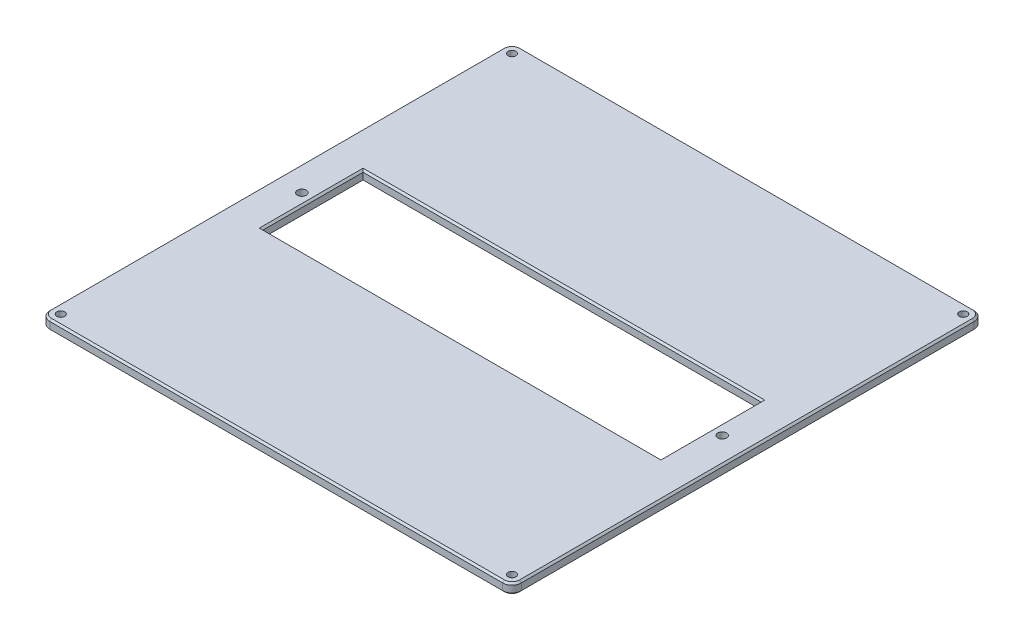
from build123d import *

# Parameters (mm, degrees)
SKETCH1_W           = 266.7
SKETCH1_H           = 266.7
SKETCH1_R           = 2.225
SKETCH1_R_2         = 2.5
SKETCH1_W_2         = 225.2
SKETCH1_H_2         = 56.7
BOSS_EXTRUDE1_DEPTH = 5.8
FILLET1_R           = 5.25
CHAMFER1_SIZE       = 1


with BuildPart() as part:
    # Sketch1 → Boss-Extrude1 (new body)
    with BuildSketch(Plane(origin=(0, 0, 0), x_dir=(1, 0, 0), z_dir=(0, 1, 0))):
        Rectangle(SKETCH1_W, SKETCH1_H)
        with Locations(Location((-127.625, 127.625, 0), (0, 0, 270))):
            Circle(SKETCH1_R, mode=Mode.SUBTRACT)
        with Locations(Location((127.625, 127.625, 0), (0, 0, 270))):
            Circle(SKETCH1_R, mode=Mode.SUBTRACT)
        with Locations(Location((127.625, -127.625, 0), (0, 0, 270))):
            Circle(SKETCH1_R, mode=Mode.SUBTRACT)
        with Locations(Location((-127.625, -127.625, 0), (0, 0, 270))):
            Circle(SKETCH1_R, mode=Mode.SUBTRACT)
        with Locations(Location((118.9, 0, 0), (0, 0, 270))):
            Circle(SKETCH1_R_2, mode=Mode.SUBTRACT)
        with Locations(Location((-118.9, 0, 0), (0, 0, 270))):
            Circle(SKETCH1_R_2, mode=Mode.SUBTRACT)
        Rectangle(SKETCH1_W_2, SKETCH1_H_2, mode=Mode.SUBTRACT)
    extrude(amount=BOSS_EXTRUDE1_DEPTH)

    # Fillet1
    fillet1_edges = [part.edges().sort_by_distance(p)[0] for p in [
        (133.35, 2.9, 133.35),
        (-133.35, 2.9, 133.35),
        (-133.35, 2.9, -133.35),
        (133.35, 2.9, -133.35),
    ]]
    fillet(fillet1_edges, radius=FILLET1_R)

    # Chamfer1
    chamfer1_edges = [part.edges().sort_by_distance(p)[0] for p in [
        (112.6, 0, 0),
        (0, 0, -28.35),
        (-112.6, 0, 0),
        (0, 0, 28.35),
        (112.6, 5.8, 0),
        (0, 5.8, -28.35),
        (-112.6, 5.8, 0),
        (0, 5.8, 28.35),
        (-133.35, 0, 0),
        (-133.35, 5.8, 0),
        (133.35, 0, 0),
        (0, 0, 133.35),
        (0, 0, -133.35),
        (-131.812310601, 0, 131.812310601),
        (131.812310601, 0, 131.812310601),
        (131.812310601, 0, -131.812310601),
        (-131.812310601, 0, -131.812310601),
        (0, 5.8, -133.35),
        (133.35, 5.8, 0),
        (0, 5.8, 133.35),
        (-131.812310601, 5.8, 131.812310601),
        (131.812310601, 5.8, 131.812310601),
        (131.812310601, 5.8, -131.812310601),
        (-131.812310601, 5.8, -131.812310601),
    ]]
    chamfer(chamfer1_edges, length=CHAMFER1_SIZE)


solid = part.part
